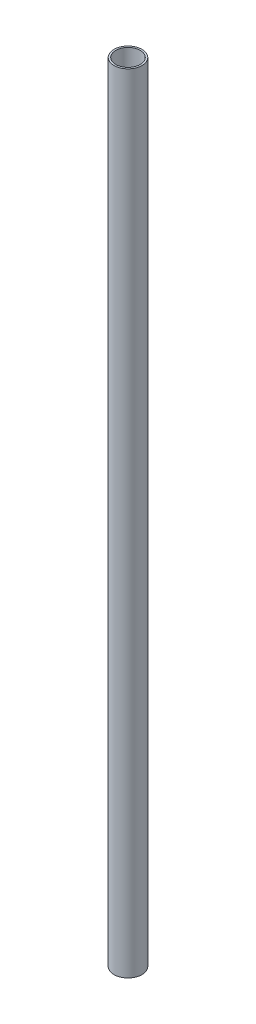
from build123d import *

# Parameters (mm, degrees)
SKETCH1_R           = 4
SKETCH1_R_2         = 3.5
BOSS_EXTRUDE1_DEPTH = 225


with BuildPart() as part:
    # Sketch1 → Boss-Extrude1 (new body)
    with BuildSketch(Plane(origin=(0, 0, 0), x_dir=(1, 0, 0), z_dir=(0, 1, 0))):
        with Locations(Location((0, 0, 0), (0, 0, 270))):
            Circle(SKETCH1_R)
        with Locations(Location((0, 0, 0), (0, 0, 270))):
            Circle(SKETCH1_R_2, mode=Mode.SUBTRACT)
    extrude(amount=BOSS_EXTRUDE1_DEPTH)


solid = part.part
